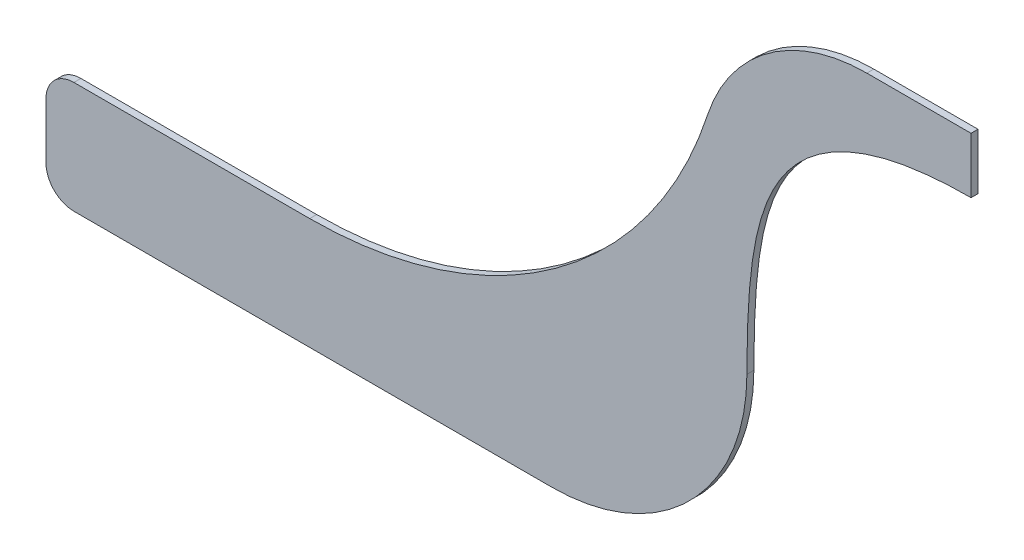
from build123d import *

# Parameters (mm, degrees)
BOSS_EXTRUDE1_DEPTH = 6.35


with BuildPart() as part:
    # Sketch1 → Boss-Extrude1 (new body)
    with BuildSketch(Plane.XY):
        with BuildLine():
            Line((4.79079833, -60.96), (439.701599067, -60.96))
            ThreePointArc((439.701599067, -60.96), (565.425184762, -8.883585695), (617.501599067, 116.84))
            add(Edge.make_bspline(
                [(617.501599067, 116.84), (617.501599067, 198.103261629), (630.412866299, 310.67677722), (736.575869498, 358.14), (821.560436263, 358.14)],
                knots=[0, 0, 0, 0, 0.504521354, 1, 1, 1, 1], degree=3))
            Line((821.560436263, 358.14), (821.560436263, 408.94))
            Line((821.560436263, 408.94), (726.691494057, 408.94))
            ThreePointArc((726.691494057, 408.94), (637.145879185, 379.858055682), (581.775600083, 303.711428571))
            ThreePointArc((581.775600083, 303.711428571), (443.349902326, 113.344860795), (219.485865145, 40.64))
            Line((219.485865145, 40.64), (4.79079833, 40.64))
            ThreePointArc((4.79079833, 40.64), (-13.169713912, 33.200512242), (-20.60920167, 15.24))
            Line((-20.60920167, 15.24), (-20.60920167, -35.56))
            ThreePointArc((-20.60920167, -35.56), (-13.169713912, -53.520512242), (4.79079833, -60.96))
        make_face()
    extrude(amount=BOSS_EXTRUDE1_DEPTH)


solid = part.part
